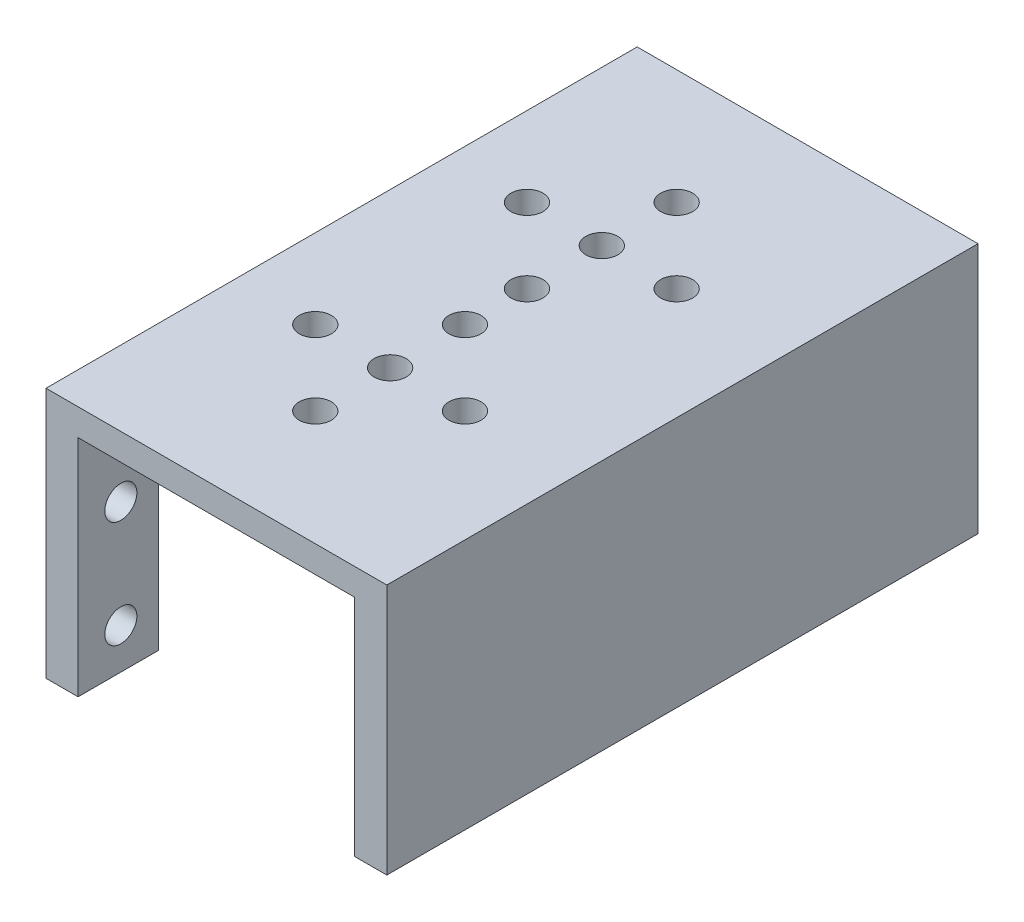
from build123d import *

# Parameters (mm, degrees)
CROQUIS1_W               = 28.88
CROQUIS1_H               = 55.3
CROQUIS1_R               = 1.5
SALIENTE_EXTRUIR8_DEPTH  = 3
CROQUIS19_W              = 28.88
CROQUIS19_H              = 55.3
CORTAR_EXTRUIR3_DEPTH    = 0.5
CROQUIS20_W              = 3
CROQUIS20_H              = 7.5
SALIENTE_EXTRUIR18_DEPTH = 23.5
SALIENTE_EXTRUIR19_START = -2.5
CROQUIS21_W              = 28.88
CROQUIS21_H              = 55.3
CROQUIS21_R              = 1.5
SALIENTE_EXTRUIR19_DEPTH = 2.5
CROQUIS22_R              = 1.5
CORTAR_EXTRUIR4_DEPTH    = 3
CROQUIS23_W              = 55.3
CROQUIS23_H              = 2.5
CORTAR_EXTRUIR5_DEPTH    = 68.588049239
CROQUIS24_W              = 55.3
CROQUIS24_H              = 23.5
SALIENTE_EXTRUIR20_DEPTH = 3


with BuildPart() as part:
    # Croquis1 → Saliente-Extruir8 (new body)
    with BuildSketch(Plane(origin=(0, 0, 0), x_dir=(1, 0, 0), z_dir=(0, 1, 0))):
        with Locations((14.44, 27.65)):
            Rectangle(CROQUIS1_W, CROQUIS1_H)
        with Locations(Location((14.44, 17.75, 0), (0, 0, 270))):
            Circle(CROQUIS1_R, mode=Mode.SUBTRACT)
        with Locations(Location((21.44, 17.75, 0), (0, 0, 270))):
            Circle(CROQUIS1_R, mode=Mode.SUBTRACT)
        with Locations(Location((14.44, 24.75, 0), (0, 0, 270))):
            Circle(CROQUIS1_R, mode=Mode.SUBTRACT)
        with Locations(Location((7.44, 17.75, 0), (0, 0, 270))):
            Circle(CROQUIS1_R, mode=Mode.SUBTRACT)
        with Locations(Location((14.44, 10.75, 0), (0, 0, 270))):
            Circle(CROQUIS1_R, mode=Mode.SUBTRACT)
        with Locations(Location((21.44, 37.55, 0), (0, 0, 90))):
            Circle(CROQUIS1_R, mode=Mode.SUBTRACT)
        with Locations(Location((14.44, 44.55, 0), (0, 0, 90))):
            Circle(CROQUIS1_R, mode=Mode.SUBTRACT)
        with Locations(Location((14.44, 30.55, 0), (0, 0, 90))):
            Circle(CROQUIS1_R, mode=Mode.SUBTRACT)
        with Locations(Location((14.44, 37.55, 0), (0, 0, 90))):
            Circle(CROQUIS1_R, mode=Mode.SUBTRACT)
        with Locations(Location((7.44, 37.55, 0), (0, 0, 90))):
            Circle(CROQUIS1_R, mode=Mode.SUBTRACT)
    extrude(amount=SALIENTE_EXTRUIR8_DEPTH)

    # Croquis19 → Cortar-Extruir3 (cut)
    with BuildSketch(Plane(origin=(0, 3, 0), x_dir=(1, 0, 0), z_dir=(0, 1, 0))):
        with Locations((14.44, 27.65)):
            Rectangle(CROQUIS19_W, CROQUIS19_H)
    extrude(amount=-CORTAR_EXTRUIR3_DEPTH, mode=Mode.SUBTRACT)

    # Croquis20 → Saliente-Extruir18 (add)
    with BuildSketch(Plane(origin=(0, 2.5, 0), x_dir=(1, 0, 0), z_dir=(0, 1, 0))):
        with Locations((1.5, 51.55)):
            Rectangle(CROQUIS20_W, CROQUIS20_H)
        with Locations((1.5, 3.75)):
            Rectangle(CROQUIS20_W, CROQUIS20_H)
    extrude(amount=SALIENTE_EXTRUIR18_DEPTH)

    # Croquis21 → Saliente-Extruir19 (add)
    with BuildSketch(Plane(origin=(0, 26, 0), x_dir=(1, 0, 0), z_dir=(0, 1, 0)).offset(SALIENTE_EXTRUIR19_START)):
        with Locations((14.44, 27.65)):
            Rectangle(CROQUIS21_W, CROQUIS21_H)
        with Locations(Location((14.44, 44.55, 0), (0, 0, 90))):
            Circle(CROQUIS21_R, mode=Mode.SUBTRACT)
        with Locations(Location((21.44, 37.55, 0), (0, 0, 90))):
            Circle(CROQUIS21_R, mode=Mode.SUBTRACT)
        with Locations(Location((14.44, 37.55, 0), (0, 0, 90))):
            Circle(CROQUIS21_R, mode=Mode.SUBTRACT)
        with Locations(Location((14.44, 30.55, 0), (0, 0, 90))):
            Circle(CROQUIS21_R, mode=Mode.SUBTRACT)
        with Locations(Location((7.44, 37.55, 0), (0, 0, 90))):
            Circle(CROQUIS21_R, mode=Mode.SUBTRACT)
        with Locations(Location((14.44, 24.75, 0), (0, 0, 270))):
            Circle(CROQUIS21_R, mode=Mode.SUBTRACT)
        with Locations(Location((21.44, 17.75, 0), (0, 0, 270))):
            Circle(CROQUIS21_R, mode=Mode.SUBTRACT)
        with Locations(Location((14.44, 17.75, 0), (0, 0, 270))):
            Circle(CROQUIS21_R, mode=Mode.SUBTRACT)
        with Locations(Location((7.44, 17.75, 0), (0, 0, 270))):
            Circle(CROQUIS21_R, mode=Mode.SUBTRACT)
        with Locations(Location((14.44, 10.75, 0), (0, 0, 270))):
            Circle(CROQUIS21_R, mode=Mode.SUBTRACT)
    extrude(amount=SALIENTE_EXTRUIR19_DEPTH)

    # Croquis22 → Cortar-Extruir4 (cut)
    with BuildSketch(Plane.ZY):
        with Locations((-51.3, 6.3)):
            Circle(CROQUIS22_R)
        with Locations((-51.3, 16.3)):
            Circle(CROQUIS22_R)
        with Locations(Location((-4, 16.3, 0), (0, 0, 180))):
            Circle(CROQUIS22_R)
        with Locations(Location((-4, 6.3, 0), (0, 0, 180))):
            Circle(CROQUIS22_R)
    extrude(amount=-CORTAR_EXTRUIR4_DEPTH, mode=Mode.SUBTRACT)

    # Croquis23 → Cortar-Extruir5 (cut, through all)
    with BuildSketch(Plane.ZY):
        with Locations((-27.65, 1.25)):
            Rectangle(CROQUIS23_W, CROQUIS23_H)
    extrude(amount=-CORTAR_EXTRUIR5_DEPTH, mode=Mode.SUBTRACT)

    # Croquis24 → Saliente-Extruir20 (add)
    with BuildSketch(Plane(origin=(28.88, 0, 0), x_dir=(0, 0, -1), z_dir=(1, 0, 0))):
        with Locations((27.65, 14.25)):
            Rectangle(CROQUIS24_W, CROQUIS24_H)
    extrude(amount=SALIENTE_EXTRUIR20_DEPTH)


solid = part.part
